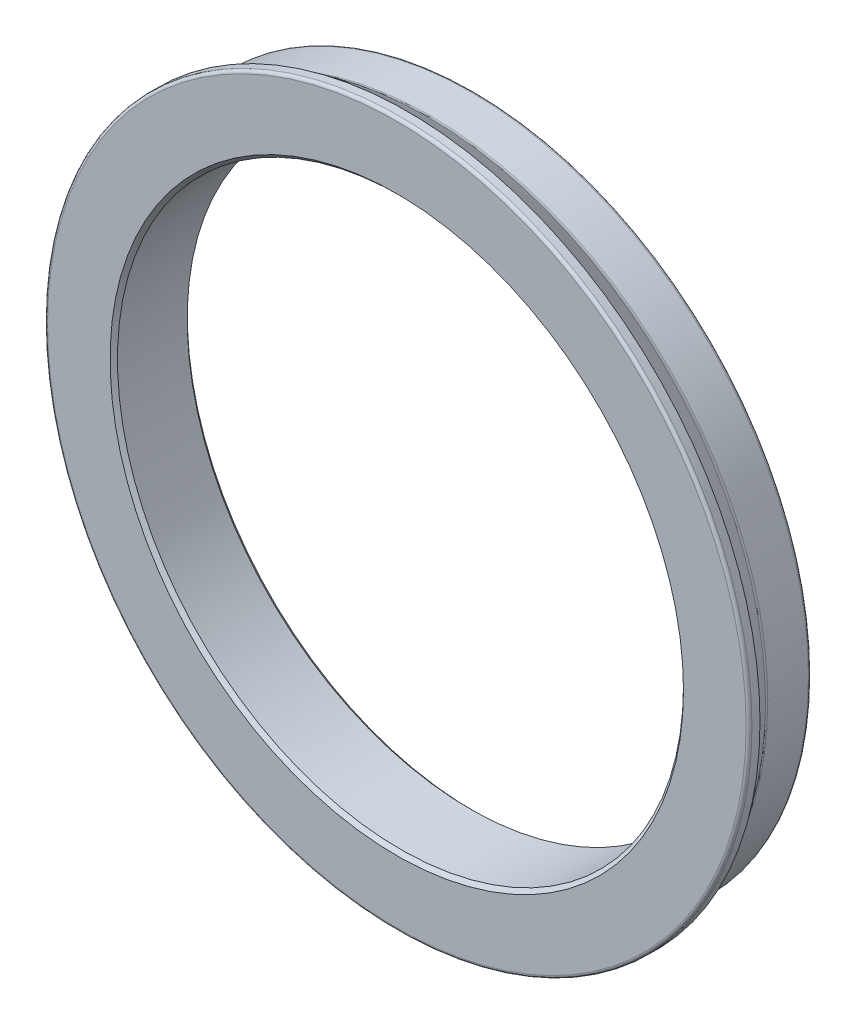
from build123d import *


with BuildPart() as part:
    # Sketch1 → Revolve1 (revolve)
    with BuildSketch(Plane(origin=(0, 0, 0), x_dir=(0, 0, -1), z_dir=(1, 0, 0)), mode=Mode.PRIVATE) as revolve1_sk:
        with BuildLine():
            Line((0, 39.05), (0.5, 38.55))
            Line((0.5, 38.55), (10, 38.55))
            Line((10, 38.55), (10.5, 39.05))
            Line((10.5, 39.05), (10.5, 45.575))
            ThreePointArc((10.5, 45.575), (10.382842712, 45.857842712), (10.1, 45.975))
            Line((10.1, 45.975), (4.556372043, 45.975))
            ThreePointArc((4.556372043, 45.975), (4.312230098, 46.013163593), (4.091381488, 46.124013223))
            Line((4.091381488, 46.124013223), (1.5, 47.975))
            Line((1.5, 47.975), (0.4, 47.975))
            ThreePointArc((0.4, 47.975), (0.117157288, 47.857842712), (0, 47.575))
            Line((0, 47.575), (0, 39.05))
        make_face()
    revolve(revolve1_sk.sketch.rotate(Axis((0, 0, 0), (0, 0, -1)), 90), axis=Axis((0, 0, 0), (0, 0, -1)))


solid = part.part
